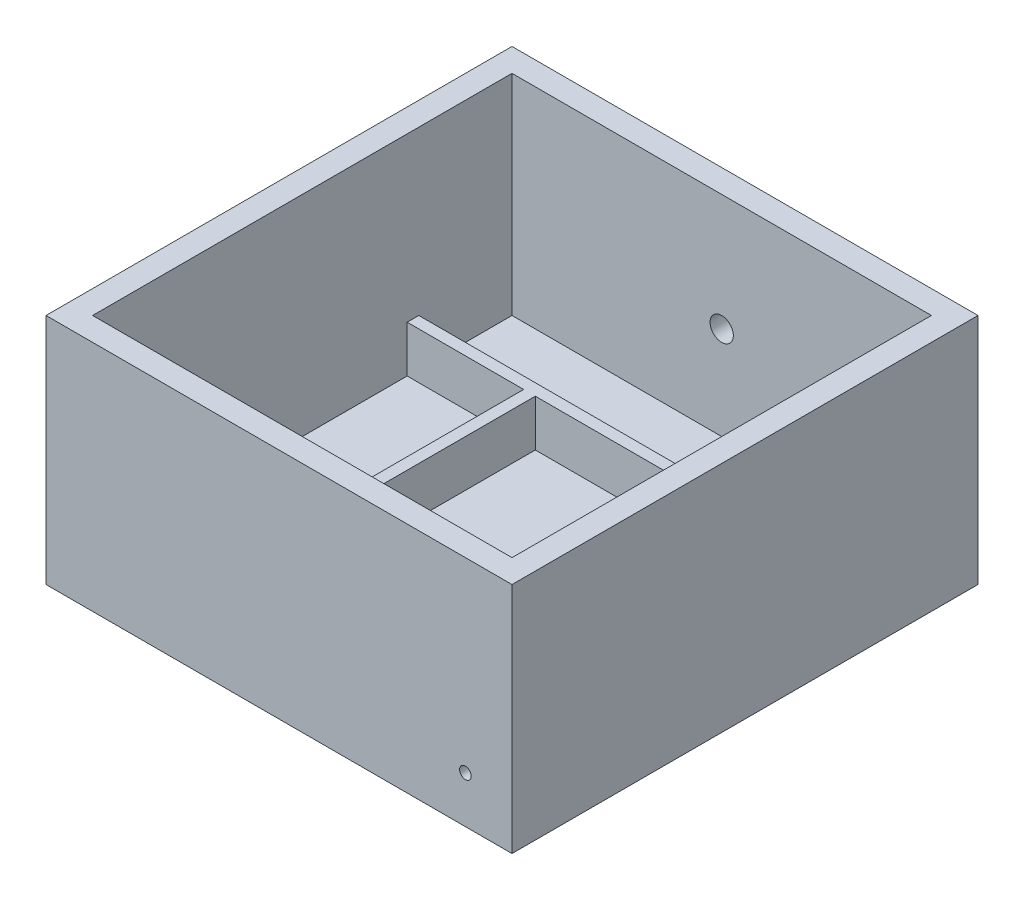
from build123d import *

# Parameters (mm, degrees)
SKETCH1_W           = 200
SKETCH1_H           = 200
SKETCH1_W_2         = 180
SKETCH1_H_2         = 180
BOSS_EXTRUDE1_DEPTH = 100
SKETCH2_W           = 200
SKETCH2_H           = 200
BOSS_EXTRUDE2_DEPTH = 10
SKETCH3_R           = 5
CUT_EXTRUDE1_DEPTH  = 10
SKETCH4_W           = 5
SKETCH4_H           = 135
BOSS_EXTRUDE3_DEPTH = 20
SKETCH6_R           = 2.5
CUT_EXTRUDE2_DEPTH  = 10


with BuildPart() as part:
    # Sketch1 → Boss-Extrude1 (new body)
    with BuildSketch(Plane(origin=(0, 0, 0), x_dir=(1, 0, 0), z_dir=(0, 1, 0))):
        with Locations((-4365.052631579, -2446.684210526)):
            Rectangle(SKETCH1_W, SKETCH1_H)
        with Locations((-4365.052631579, -2446.684210526)):
            Rectangle(SKETCH1_W_2, SKETCH1_H_2, mode=Mode.SUBTRACT)
    extrude(amount=BOSS_EXTRUDE1_DEPTH)

    # Sketch2 → Boss-Extrude2 (add)
    with BuildSketch(Plane(origin=(0, 0, 0), x_dir=(1, 0, 0), z_dir=(0, 1, 0))):
        with Locations((-4365.052631579, -2446.684210526)):
            Rectangle(SKETCH2_W, SKETCH2_H)
    extrude(amount=BOSS_EXTRUDE2_DEPTH)

    # Sketch3 → Cut-Extrude1 (cut)
    with BuildSketch(Plane(origin=(0, 0, 2346.684210526), x_dir=(-1, 0, 0), z_dir=(0, 0, -1))):
        with Locations((4365.052631579, 50)):
            Circle(SKETCH3_R)
    extrude(amount=-CUT_EXTRUDE1_DEPTH, mode=Mode.SUBTRACT)

    # Sketch4 → Boss-Extrude3 (add)
    with BuildSketch(Plane(origin=(0, 10, 0), x_dir=(1, 0, 0), z_dir=(0, 1, 0))):
        with Locations((-4402.552631579, -2469.184210526)):
            Rectangle(SKETCH4_W, SKETCH4_H)
        Polygon((-4275.052631579, -2396.684210526), (-4455.052631579, -2396.684210526), (-4455.052631579, -2401.684210526), (-4405.052631579, -2401.684210526), (-4400.052631579, -2401.684210526), (-4275.052631579, -2401.684210526), align=None)
    extrude(amount=BOSS_EXTRUDE3_DEPTH)

    # Sketch6 → Cut-Extrude2 (cut)
    with BuildSketch(Plane.XY.offset(2546.684210526)):
        with Locations((-4285.052631579, 20)):
            Circle(SKETCH6_R)
    extrude(amount=-CUT_EXTRUDE2_DEPTH, mode=Mode.SUBTRACT)


solid = part.part
